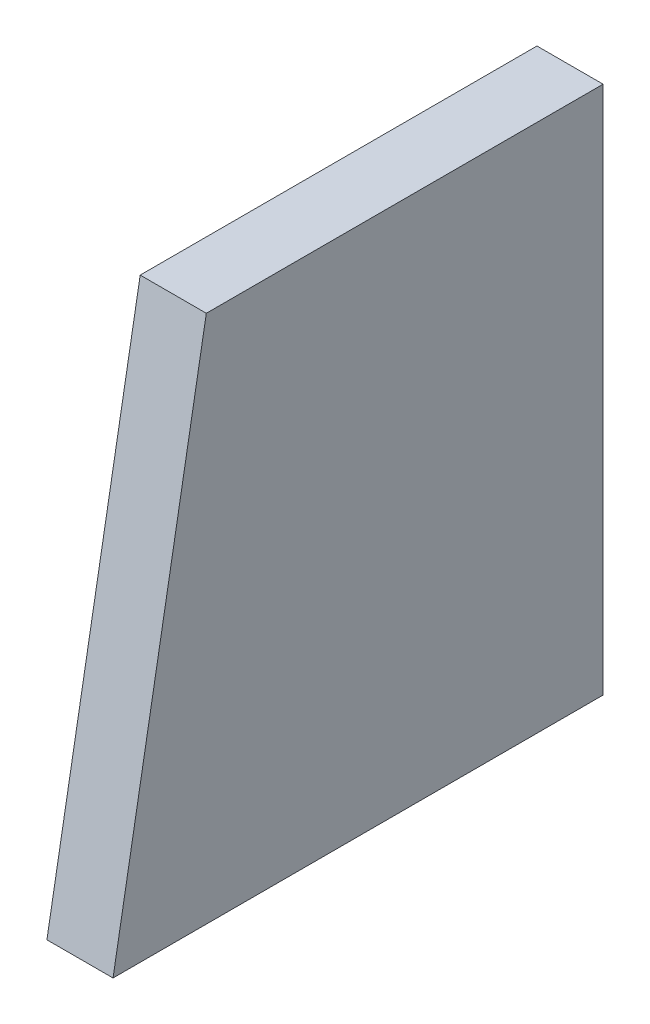
from build123d import *

# Parameters (mm, degrees)
BOSS_EXTRUDE1_DEPTH = 6.35


with BuildPart() as part:
    # Sketch1 → Boss-Extrude1 (new body)
    with BuildSketch(Plane(origin=(0, 0, 0), x_dir=(0, 0, -1), z_dir=(1, 0, 0))):
        Polygon((0, 0), (8.95741062, 50.8), (47.05741062, 50.8), (47.05741062, 0), align=None)
    extrude(amount=BOSS_EXTRUDE1_DEPTH)


solid = part.part
